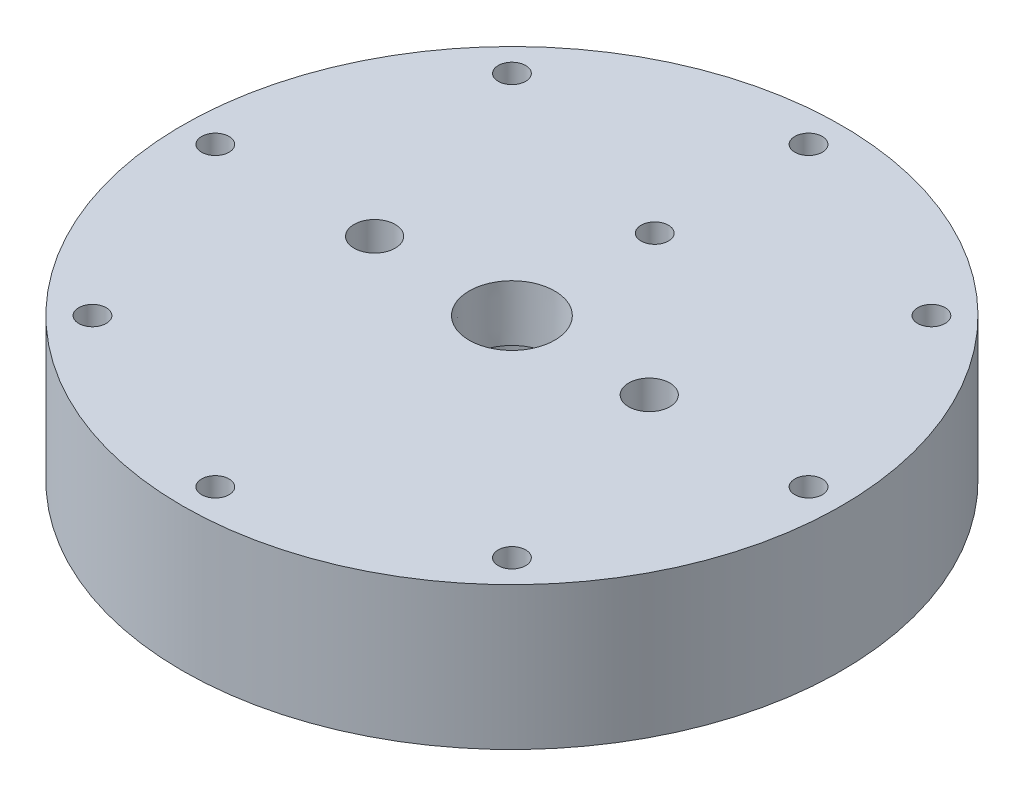
from build123d import *

# Parameters (mm, degrees)
SKETCH1_R             = 76.2
BILLET_DEPTH          = 50.8
SKETCH3_R             = 19.05
LOX_PLATE_DEPTH       = 13.97
SKETCH5_R             = 13.97
LOX_DOME_DEPTH        = 20.32
SKETCH7_R             = 76.2
TOP_MILL_DEPTH        = 17.78
F_1_4_BOLT_HOLE_REACH = 114.708
SKETCH11_R            = 3.175
BOLT_PATTERN_COUNT    = 8
SKETCH12_R            = 57.15
KEROSENE_PLATE_DEPTH  = 10.16
KEROSENE_INLET_REACH  = 121.137
SKETCH13_R            = 4.7625
MANIFOLD_HOLE_REACH   = 121.137
SKETCH14_R            = 3.175
SKETCH15_R            = 10.16
SKETCH15_R_2          = 7.62
MANIFOLD_SEAL_DEPTH   = 12.192


with BuildPart() as part:
    # Sketch1 → Billet (new body)
    with BuildSketch(Plane(origin=(0, 0, 0), x_dir=(1, 0, 0), z_dir=(0, 1, 0))):
        Circle(SKETCH1_R)
    extrude(amount=-BILLET_DEPTH)

    # Sketch3 → Lox Plate (cut)
    with BuildSketch(Plane(origin=(0, -50.8, 0), x_dir=(1, 0, 0), z_dir=(0, 1, 0))):
        Circle(SKETCH3_R)
    extrude(amount=LOX_PLATE_DEPTH, mode=Mode.SUBTRACT)

    # Sketch5 → Lox Dome (cut)
    with BuildSketch(Plane(origin=(0, -50.8, 0), x_dir=(1, 0, 0), z_dir=(0, 1, 0))):
        Circle(SKETCH5_R)
    extrude(amount=LOX_DOME_DEPTH, mode=Mode.SUBTRACT)

    # Sketch7 → Top Mill (cut)
    with BuildSketch(Plane(origin=(0, 0, 0), x_dir=(1, 0, 0), z_dir=(0, 1, 0))):
        Circle(SKETCH7_R)
    extrude(amount=-TOP_MILL_DEPTH, mode=Mode.SUBTRACT)

    # Sketch11 → 1/4" Bolt Hole (cut, up to next)
    with BuildSketch(Plane(origin=(0, -50.8, 0), x_dir=(1, 0, 0), z_dir=(0, 1, 0)), mode=Mode.PRIVATE) as f_1_4_bolt_hole_sk1:
        with Locations((0, 68.58)):
            Circle(SKETCH11_R)
    f_1_4_bolt_hole_tool1 = extrude(f_1_4_bolt_hole_sk1.sketch, amount=F_1_4_BOLT_HOLE_REACH, mode=Mode.PRIVATE) & part.part
    f_1_4_bolt_hole = f_1_4_bolt_hole_tool1.solids().sort_by_distance((0, -50.8, -68.58))[0]
    add(f_1_4_bolt_hole, mode=Mode.SUBTRACT)

    # Bolt Pattern: 1/4" Bolt Hole ×8 about axis
    bolt_pattern_axis = Axis((0, 53.34, 0), (0, -1, 0))
    for i in range(1, BOLT_PATTERN_COUNT):
        add(f_1_4_bolt_hole.rotate(bolt_pattern_axis, i * 360 / BOLT_PATTERN_COUNT), mode=Mode.SUBTRACT)

    # Sketch12 → Kerosene Plate (cut)
    with BuildSketch(Plane(origin=(0, -50.8, 0), x_dir=(1, 0, 0), z_dir=(0, 1, 0))):
        Circle(SKETCH12_R)
    extrude(amount=KEROSENE_PLATE_DEPTH, mode=Mode.SUBTRACT)

    # Sketch13 → Kerosene Inlet (cut, up to next)
    with BuildSketch(Plane(origin=(0, 0, 0), x_dir=(1, 0, 0), z_dir=(0, 1, 0)), mode=Mode.PRIVATE) as kerosene_inlet_sk1:
        with Locations((-31.75, 0)):
            Circle(SKETCH13_R)
    kerosene_inlet_tool1 = extrude(kerosene_inlet_sk1.sketch, amount=-KEROSENE_INLET_REACH, mode=Mode.PRIVATE) & part.part
    # Sketch13 → Kerosene Inlet (cut, up to next)
    with BuildSketch(Plane(origin=(0, 0, 0), x_dir=(1, 0, 0), z_dir=(0, 1, 0)), mode=Mode.PRIVATE) as kerosene_inlet_sk2:
        with Locations((31.75, 0)):
            Circle(SKETCH13_R)
    kerosene_inlet_tool2 = extrude(kerosene_inlet_sk2.sketch, amount=-KEROSENE_INLET_REACH, mode=Mode.PRIVATE) & part.part
    add(kerosene_inlet_tool1.solids().sort_by_distance((-31.75, 0, 0))[0], mode=Mode.SUBTRACT)
    add(kerosene_inlet_tool2.solids().sort_by_distance((31.75, 0, 0))[0], mode=Mode.SUBTRACT)

    # Sketch14 → Manifold hole (cut, up to next)
    with BuildSketch(Plane(origin=(0, 0, 0), x_dir=(1, 0, 0), z_dir=(0, 1, 0)), mode=Mode.PRIVATE) as manifold_hole_sk1:
        with Locations((0, 33.02)):
            Circle(SKETCH14_R)
    manifold_hole_tool1 = extrude(manifold_hole_sk1.sketch, amount=-MANIFOLD_HOLE_REACH, mode=Mode.PRIVATE) & part.part
    add(manifold_hole_tool1.solids().sort_by_distance((0, 0, -33.02))[0], mode=Mode.SUBTRACT)

    # Sketch15 → Manifold seal (cut)
    with BuildSketch(Plane(origin=(0, -50.8, 0), x_dir=(1, 0, 0), z_dir=(0, 1, 0))):
        with Locations((0, 33.02)):
            Circle(SKETCH15_R)
        with Locations((0, 33.02)):
            Circle(SKETCH15_R_2, mode=Mode.SUBTRACT)
    extrude(amount=MANIFOLD_SEAL_DEPTH, mode=Mode.SUBTRACT)

    # Sketch21 → 1/2 NPT Tapped Hole3 (revolve, cut)
    with BuildSketch(Plane(origin=(0, -17.78, 0), x_dir=(0, 0, 1), z_dir=(1, 0, 0))):
        Polygon((0, 0), (0, 33.02), (8.9281, 33.02), (8.9281, 13.462), (9.479726792, 13.462), (9.8827971, 0), align=None)
    revolve(axis=Axis((0, -11.43, 0), (0, -1, 0)), mode=Mode.SUBTRACT)


solid = part.part
